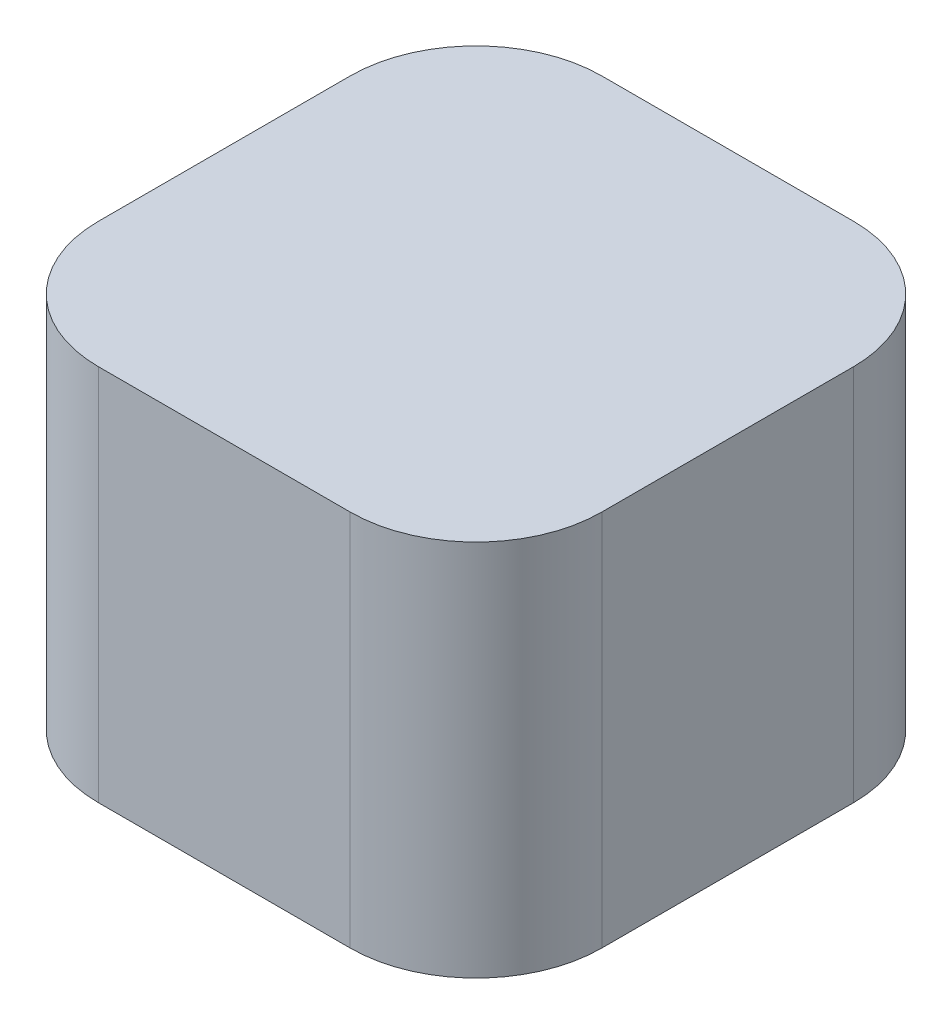
from build123d import *

# Parameters (mm, degrees)
SKETCH1_W           = 40
SKETCH1_H           = 40
BOSS_EXTRUDE1_DEPTH = 30
SKETCH2_R           = 10
BOSS_EXTRUDE2_DEPTH = 10
FILLET1_R           = 10


with BuildPart() as part:
    # Sketch1 → Boss-Extrude1 (new body)
    with BuildSketch(Plane(origin=(0, 0, 0), x_dir=(1, 0, 0), z_dir=(0, 1, 0))):
        Rectangle(SKETCH1_W, SKETCH1_H)
    extrude(amount=BOSS_EXTRUDE1_DEPTH)

    # Sketch2 → Boss-Extrude2 (add)
    with BuildSketch(Plane(origin=(0, 0, 0), x_dir=(-1, 0, 0), z_dir=(0, -1, 0))):
        with Locations(Location((0, 0, 0), (0, 0, 90))):
            Circle(SKETCH2_R)
    extrude(amount=BOSS_EXTRUDE2_DEPTH)

    # Fillet1
    fillet1_edges = [part.edges().sort_by_distance(p)[0] for p in [
        (20, 15, 20),
        (-20, 15, 20),
        (-20, 15, -20),
        (20, 15, -20),
    ]]
    fillet(fillet1_edges, radius=FILLET1_R)


solid = part.part
